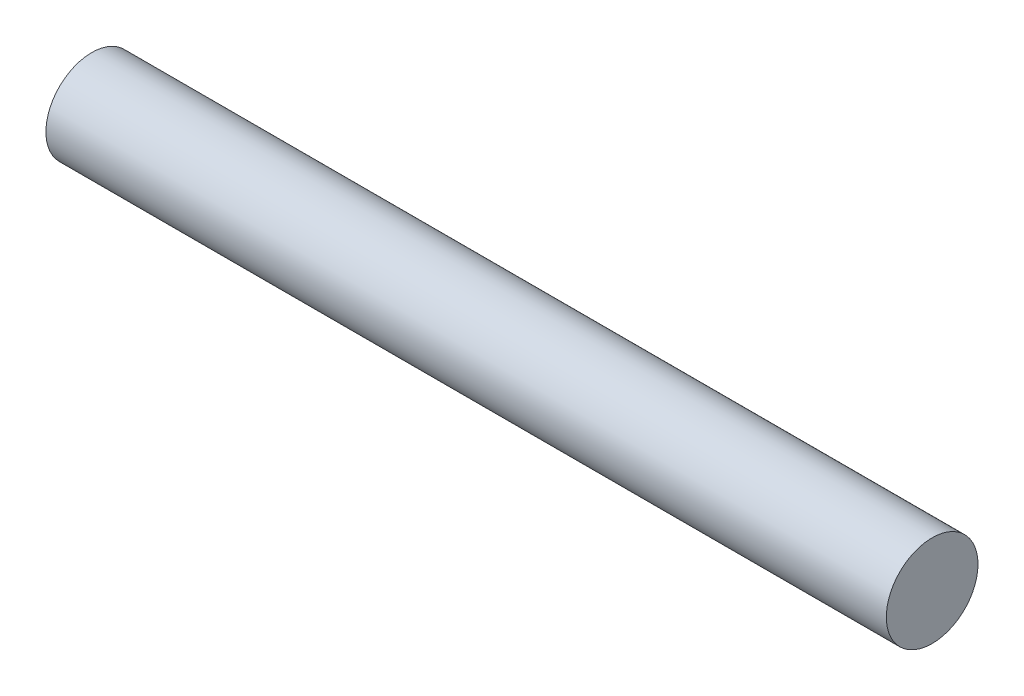
from build123d import *

# Parameters (mm, degrees)
IZIM1_R                     = 6
Y_KSEKLIK_EKSTR_ZYON1_DEPTH = 110


with BuildPart() as part:
    # Çizim1 → Yükseklik-Ekstrüzyon1 (new body)
    with BuildSketch(Plane(origin=(0, 0, 0), x_dir=(0, 0, -1), z_dir=(1, 0, 0))):
        Circle(IZIM1_R)
    extrude(amount=Y_KSEKLIK_EKSTR_ZYON1_DEPTH)


solid = part.part
